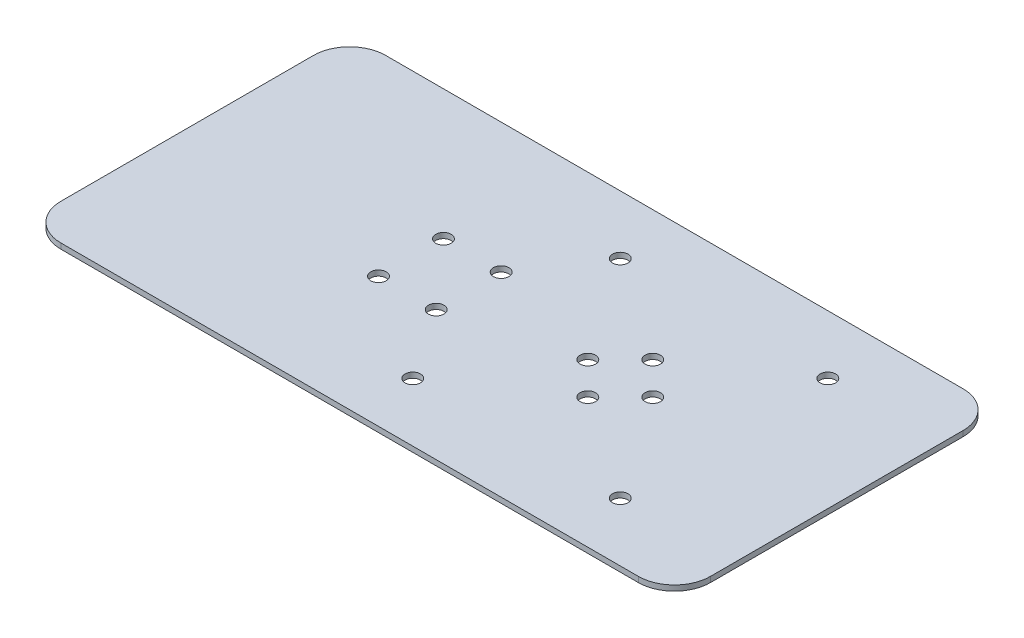
from build123d import *

# Parameters (mm, degrees)
SKETCH1_W           = 180
SKETCH1_H           = 120
BOSS_EXTRUDE1_DEPTH = 1.5
SKETCH2_R           = 2.15
CUT_EXTRUDE1_DEPTH  = 217.33827678
SKETCH3_W           = 180
SKETCH3_H           = 15
CUT_EXTRUDE2_DEPTH  = 217.33827678
FILLET1_R           = 10


with BuildPart() as part:
    # Sketch1 → Boss-Extrude1 (new body)
    with BuildSketch(Plane(origin=(0, 0, 0), x_dir=(1, 0, 0), z_dir=(0, 1, 0))):
        with Locations((90, -60)):
            Rectangle(SKETCH1_W, SKETCH1_H)
    extrude(amount=BOSS_EXTRUDE1_DEPTH)

    # Sketch2 → Cut-Extrude1 (cut, through all)
    with BuildSketch(Plane(origin=(0, 1.5, 0), x_dir=(1, 0, 0), z_dir=(0, 1, 0))):
        with Locations(Location((120, -51, 0), (0, 0, 270))):
            Circle(SKETCH2_R)
        with Locations(Location((120, -69, 0), (0, 0, 270))):
            Circle(SKETCH2_R)
        with Locations(Location((129, -60, 0), (0, 0, 270))):
            Circle(SKETCH2_R)
        with Locations(Location((111, -60, 0), (0, 0, 270))):
            Circle(SKETCH2_R)
        with Locations(Location((78, -51, 0), (0, 0, 270))):
            Circle(SKETCH2_R)
        with Locations(Location((62, -51, 0), (0, 0, 270))):
            Circle(SKETCH2_R)
        with Locations(Location((62, -69, 0), (0, 0, 270))):
            Circle(SKETCH2_R)
        with Locations(Location((78, -69, 0), (0, 0, 270))):
            Circle(SKETCH2_R)
        with Locations(Location((148.75, -31.25, 0), (0, 0, 270))):
            Circle(SKETCH2_R)
        with Locations(Location((91.25, -31.25, 0), (0, 0, 270))):
            Circle(SKETCH2_R)
        with Locations(Location((91.25, -88.75, 0), (0, 0, 270))):
            Circle(SKETCH2_R)
        with Locations(Location((148.75, -88.75, 0), (0, 0, 270))):
            Circle(SKETCH2_R)
    extrude(amount=-CUT_EXTRUDE1_DEPTH, mode=Mode.SUBTRACT)

    # Sketch3 → Cut-Extrude2 (cut, through all)
    with BuildSketch(Plane(origin=(0, 1.5, 0), x_dir=(1, 0, 0), z_dir=(0, 1, 0))):
        with Locations((90, -7.5)):
            Rectangle(SKETCH3_W, SKETCH3_H)
        with Locations((90, -112.5)):
            Rectangle(SKETCH3_W, SKETCH3_H)
    extrude(amount=-CUT_EXTRUDE2_DEPTH, mode=Mode.SUBTRACT)

    # Fillet1
    fillet1_edges = [part.edges().sort_by_distance(p)[0] for p in [
        (0, 0.75, 15),
        (180, 0.75, 15),
        (0, 0.75, 105),
        (180, 0.75, 105),
    ]]
    fillet(fillet1_edges, radius=FILLET1_R)


solid = part.part
